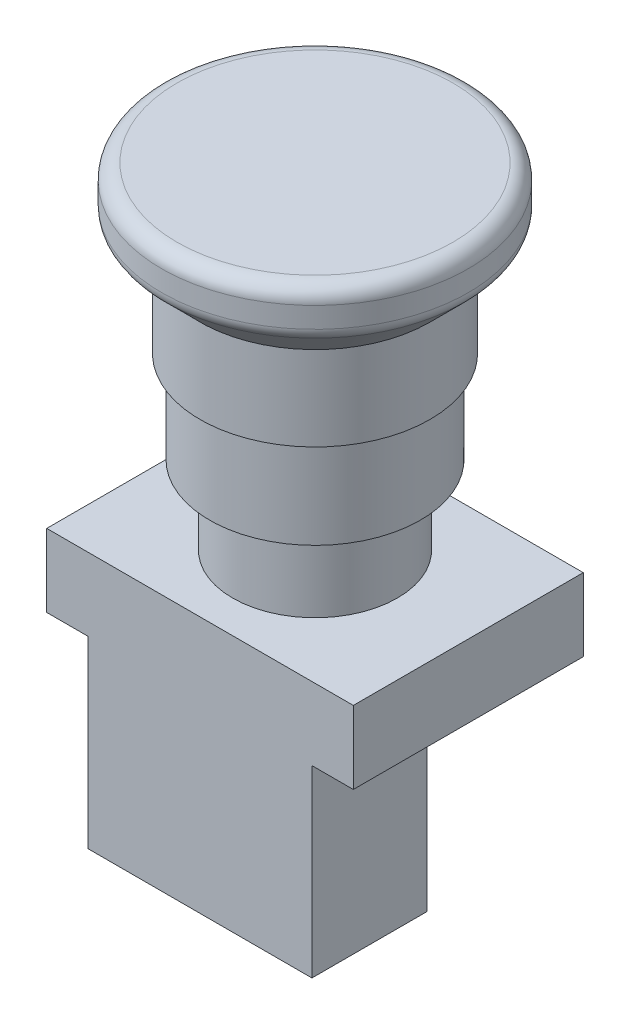
from build123d import *

# Parameters (mm, degrees)
CROQUIS1_W              = 13.75
CROQUIS1_H              = 12
CROQUIS5_R              = 10.75
SALIENTE_EXTRUIR3_DEPTH = 10.3
CROQUIS8_W              = 40
CROQUIS8_H              = 30
SALIENTE_EXTRUIR4_DEPTH = 9.5
CROQUIS9_W              = 29.2
CROQUIS9_H              = 15
SALIENTE_EXTRUIR5_DEPTH = 24


with BuildPart() as part:
    # Croquis1 → Revolución1 (revolve)
    with BuildSketch(Plane.XY, mode=Mode.PRIVATE) as revoluci_n1_sk:
        with Locations((6.875, 6)):
            Rectangle(CROQUIS1_W, CROQUIS1_H)
    revolve(revoluci_n1_sk.sketch.rotate(Axis((0, 0, 0), (0, 1, 0)), 90), axis=Axis((0, 0, 0), (0, 1, 0)))

    # Croquis2 → Revolución2 (revolve)
    with BuildSketch(Plane.XY, mode=Mode.PRIVATE) as revoluci_n2_sk:
        with BuildLine():
            Line((0, 12), (15, 12))
            Line((15, 12), (15, 23))
            Line((15, 23), (19.414213562, 27.414213562))
            ThreePointArc((19.414213562, 27.414213562), (19.847759065, 28.06306026), (20, 28.828427125))
            Line((20, 28.828427125), (20, 31.528143579))
            ThreePointArc((20, 31.528143579), (19.414213562, 32.942357141), (18, 33.528143579))
            Line((18, 33.528143579), (0, 33.528143579))
            Line((0, 33.528143579), (0, 28))
            Line((0, 28), (0, 12))
        make_face()
    revolve(revoluci_n2_sk.sketch.rotate(Axis((0, 28, 0), (0, -1, 0)), 180), axis=Axis((0, 28, 0), (0, -1, 0)))

    # Croquis5 → Saliente-Extruir3 (add)
    with BuildSketch(Plane.XZ):
        with Locations(Location((0, 0, 0), (0, 0, 90))):
            Circle(CROQUIS5_R)
    extrude(amount=SALIENTE_EXTRUIR3_DEPTH)

    # Croquis8 → Saliente-Extruir4 (add)
    with BuildSketch(Plane.XZ.offset(10.3)):
        Rectangle(CROQUIS8_W, CROQUIS8_H)
    extrude(amount=SALIENTE_EXTRUIR4_DEPTH)

    # Croquis9 → Saliente-Extruir5 (add)
    with BuildSketch(Plane.XZ.offset(19.8)):
        with Locations((0, 7.5)):
            Rectangle(CROQUIS9_W, CROQUIS9_H)
    extrude(amount=SALIENTE_EXTRUIR5_DEPTH)


solid = part.part
